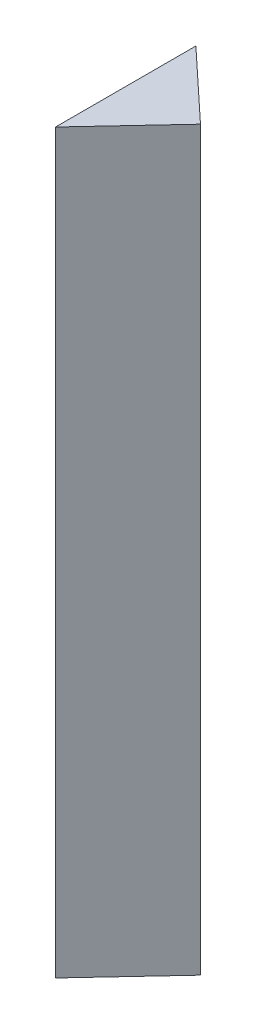
from build123d import *

# Parameters (mm, degrees)
BOSS_EXTRUDE1_DEPTH = 133.401022209


with BuildPart() as part:
    # Sketch1 → Boss-Extrude1 (new body)
    with BuildSketch(Plane.XZ.offset(251.789847126)):
        Polygon((-57.150000006, 15.081250007), (-57.15, -10.31875), (-44.479485361, 1.516346092), align=None)
    extrude(amount=-BOSS_EXTRUDE1_DEPTH)


solid = part.part
